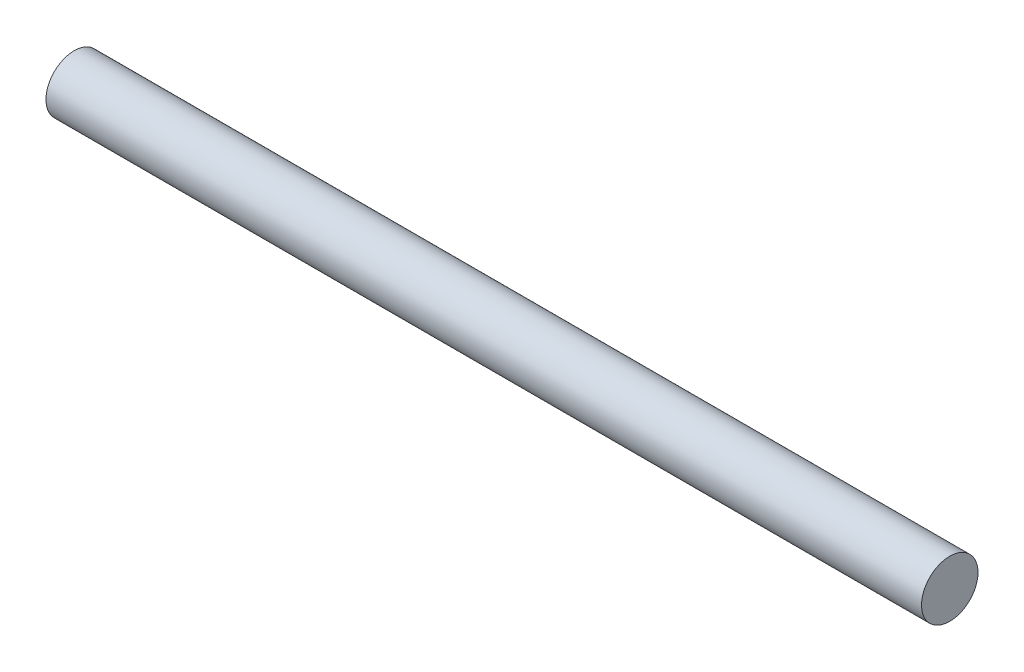
from build123d import *

# Parameters (mm, degrees)
CROQUIS1_R              = 10
SALIENTE_EXTRUIR1_DEPTH = 310


with BuildPart() as part:
    # Croquis1 → Saliente-Extruir1 (new body)
    with BuildSketch(Plane(origin=(0, 0, 0), x_dir=(0, 0, -1), z_dir=(1, 0, 0))):
        Circle(CROQUIS1_R)
    extrude(amount=SALIENTE_EXTRUIR1_DEPTH)


solid = part.part
